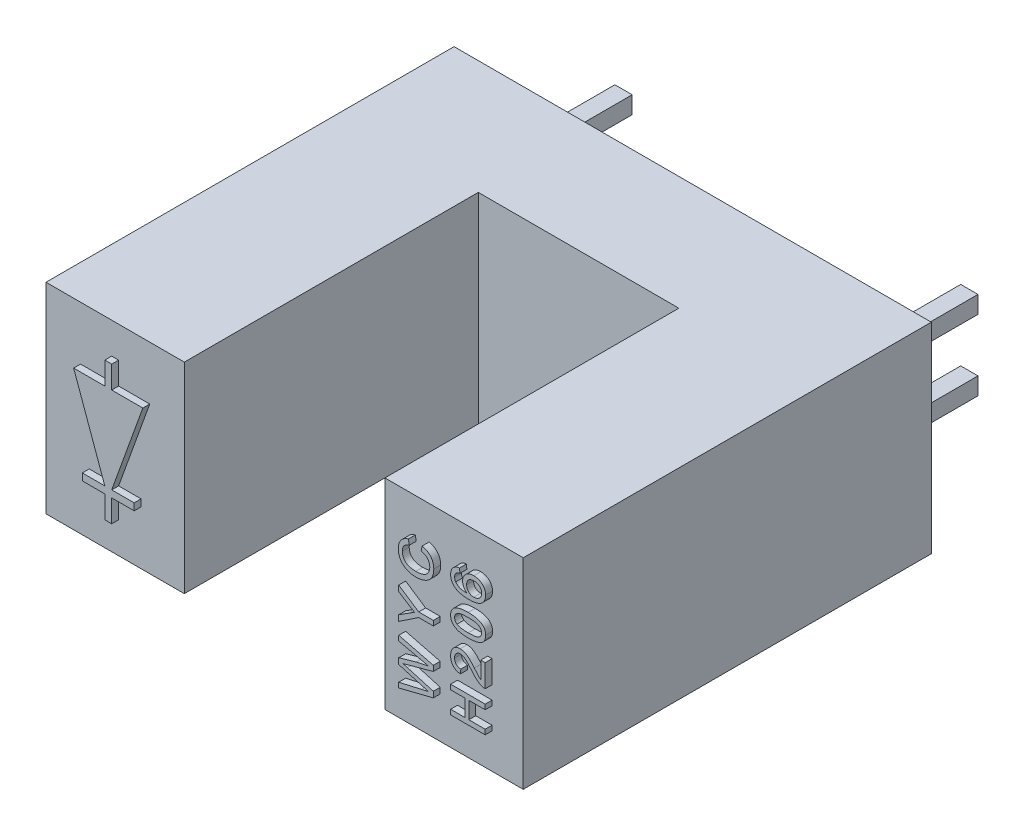
from build123d import *

# Parameters (mm, degrees)
SKETCH1_W           = 13.8
SKETCH1_H           = 5.8
BOSS_EXTRUDE1_DEPTH = 11.8
SKETCH2_W           = 5.8
SKETCH2_H           = 8.5
CUT_EXTRUDE1_DEPTH  = 11.8
BOSS_EXTRUDE3_DEPTH = 0.2
SKETCH4_W           = 0.5
SKETCH4_H           = 0.5
BOSS_EXTRUDE4_DEPTH = 3


with BuildPart() as part:
    # Sketch1 → Boss-Extrude1 (new body)
    with BuildSketch(Plane.XY):
        Rectangle(SKETCH1_W, SKETCH1_H)
    extrude(amount=BOSS_EXTRUDE1_DEPTH)

    # Sketch2 → Cut-Extrude1 (cut)
    with BuildSketch(Plane.XZ.offset(2.9)):
        with Locations((0, 7.55)):
            Rectangle(SKETCH2_W, SKETCH2_H)
    extrude(amount=-CUT_EXTRUDE1_DEPTH, mode=Mode.SUBTRACT)

    # Sketch3 → Boss-Extrude3 (add)
    # profile 1 of 8: a face of its own
    with BuildSketch(Plane.XY.offset(11.8)):
        Polygon((-5, 2), (-4.8, 2), (-4.8, 1.35), (-3.9, 1.35), (-4.8, -1.15), (-4.15, -1.15), (-4.15, -1.35), (-4.8, -1.35), (-4.8, -2), (-5, -2), (-5, -1.35), (-5.65, -1.35), (-5.65, -1.15), (-5, -1.15), (-5.9, 1.35), (-5, 1.35), align=None)
    # profile 2 of 8: a face of its own
    with BuildSketch(Plane.XY.offset(11.8)):
        with BuildLine():
            Line((4.147035256, 1.794871795), (4.179887821, 1.935897436))
            add(Edge.make_bspline(
                [(4.179887821, 1.935897436), (4.193105847, 1.932364452), (4.218961948, 1.925453496), (4.255963458, 1.911787877), (4.290693221, 1.896456639), (4.323034673, 1.879057674), (4.35284719, 1.859536419), (4.380280463, 1.83797815), (4.405378111, 1.814386055), (4.427830497, 1.788579096), (4.447912592, 1.761229193), (4.465124945, 1.732144912), (4.480134161, 1.701842258), (4.492164862, 1.6698256), (4.501290072, 1.636330013), (4.507919874, 1.601438978), (4.512008626, 1.565067725), (4.51254649, 1.540275182), (4.512820513, 1.527644231)],
                knots=[0, 0, 0, 0, 1.145367768, 2.240481511, 3.299486216, 4.322926322, 5.312543435, 6.280301985, 7.2416403, 8.192823262, 9.141388579, 10.079393599, 11.019812878, 11.970222822, 12.938950422, 13.923894909, 14.942295558, 16, 16, 16, 16], degree=3))
            add(Edge.make_bspline(
                [(4.512820513, 1.527644231), (4.512629827, 1.514685239), (4.512256766, 1.489332008), (4.509294356, 1.452181683), (4.503980094, 1.416896693), (4.49718236, 1.38335128), (4.487849908, 1.351783346), (4.476716774, 1.32196442), (4.463237211, 1.29415183), (4.447944601, 1.268051246), (4.430561914, 1.243785067), (4.411569158, 1.22079846), (4.390440574, 1.199650254), (4.367675801, 1.179811451), (4.342974329, 1.161714205), (4.316671796, 1.144692697), (4.288304736, 1.129577742), (4.25839908, 1.11580919), (4.227244366, 1.103724238), (4.195455987, 1.093033283), (4.162970601, 1.084292842), (4.130061567, 1.076767887), (4.096451977, 1.071301371), (4.062394008, 1.066961127), (4.027678853, 1.064574774), (4.004343579, 1.064260755), (3.992588141, 1.064102564)],
                knots=[0, 0, 0, 0, 1.180680974, 2.309907975, 3.39230657, 4.430402719, 5.425739985, 6.38846843, 7.327253855, 8.238163682, 9.141319901, 10.044148192, 10.951882972, 11.861898394, 12.79276478, 13.739539846, 14.714057202, 15.718574761, 16.737652364, 17.7573291, 18.772768038, 19.801551793, 20.831755737, 21.873891013, 22.928945814, 24, 24, 24, 24], degree=3))
            add(Edge.make_bspline(
                [(3.992588141, 1.064102564), (3.979897686, 1.064328855), (3.954824551, 1.064775948), (3.91782817, 1.067298653), (3.882123066, 1.071935418), (3.847681449, 1.078363092), (3.81442905, 1.086552175), (3.782358052, 1.096521775), (3.751598924, 1.108415011), (3.722143353, 1.121922538), (3.694351096, 1.137458072), (3.667974576, 1.154181217), (3.643527226, 1.172758929), (3.620558801, 1.192550156), (3.599460217, 1.214064734), (3.580181441, 1.237232888), (3.562547222, 1.261855817), (3.54672111, 1.287929636), (3.532834533, 1.315113607), (3.520465636, 1.343003941), (3.510327644, 1.371711574), (3.501898311, 1.401008903), (3.495187778, 1.430959003), (3.490700425, 1.461631856), (3.487776117, 1.492999118), (3.487379803, 1.514149376), (3.487179487, 1.524839744)],
                knots=[0, 0, 0, 0, 1.185610122, 2.34246615, 3.46204209, 4.547238403, 5.613845268, 6.659506797, 7.682407252, 8.692734231, 9.683951048, 10.654680354, 11.607833779, 12.549673105, 13.484816388, 14.419272854, 15.362680812, 16.31159957, 17.265732262, 18.21261905, 19.159670199, 20.10733745, 21.059306249, 22.024427552, 23.00144979, 24, 24, 24, 24], degree=3))
            add(Edge.make_bspline(
                [(3.487179487, 1.524839744), (3.487396057, 1.536802694), (3.487821748, 1.560317056), (3.491591672, 1.594776525), (3.497240699, 1.627917459), (3.505768841, 1.659481701), (3.516230675, 1.689766597), (3.529723974, 1.718295083), (3.545012852, 1.745647545), (3.562967467, 1.771317241), (3.582999509, 1.795380921), (3.605059756, 1.817621691), (3.629002205, 1.837998928), (3.655014144, 1.856260397), (3.682920025, 1.872656714), (3.712665197, 1.887364078), (3.744439288, 1.900032072), (3.766573885, 1.906806801), (3.777844551, 1.91025641)],
                knots=[0, 0, 0, 0, 1.098215313, 2.158650937, 3.179873416, 4.182349117, 5.157851008, 6.118027029, 7.076341197, 8.032298369, 8.990121974, 9.948357669, 10.905435138, 11.873450097, 12.863034414, 13.874936208, 14.917943528, 16, 16, 16, 16], degree=3))
            Line((3.777844551, 1.91025641), (3.808092949, 1.769230769))
            add(Edge.make_bspline(
                [(3.808092949, 1.769230769), (3.79944349, 1.766461246), (3.782513822, 1.761040431), (3.758386038, 1.751415245), (3.73598757, 1.741020365), (3.715470675, 1.729608177), (3.696830438, 1.717153947), (3.679840314, 1.703944464), (3.664817427, 1.689663241), (3.651415387, 1.674600771), (3.639998131, 1.658368097), (3.629880563, 1.641345783), (3.621509818, 1.623174913), (3.614429898, 1.604116889), (3.609041315, 1.583993578), (3.605250235, 1.562886924), (3.603056143, 1.540778383), (3.602730293, 1.525712653), (3.602564103, 1.518028846)],
                knots=[0, 0, 0, 0, 1.235697765, 2.418642872, 3.532555292, 4.594392283, 5.610119701, 6.580908344, 7.519430642, 8.427315627, 9.319973334, 10.216139639, 11.118687699, 12.038725643, 12.980015607, 13.949697744, 14.954307006, 16, 16, 16, 16], degree=3))
            add(Edge.make_bspline(
                [(3.602564103, 1.518028846), (3.602692216, 1.509207185), (3.602944176, 1.49185758), (3.605697611, 1.466368028), (3.609761763, 1.441892607), (3.615825303, 1.418597984), (3.623481704, 1.396438827), (3.632629014, 1.375314698), (3.643761743, 1.355365347), (3.656522816, 1.336611036), (3.670848503, 1.319158304), (3.68623925, 1.302945704), (3.702731092, 1.288014027), (3.720422087, 1.274542421), (3.739376859, 1.262528378), (3.759414906, 1.251656119), (3.780670287, 1.2422685), (3.810484257, 1.231657812), (3.848957986, 1.221225174), (3.896009808, 1.211955577), (3.94376286, 1.206110642), (3.975878417, 1.205456377), (3.991987179, 1.205128205)],
                knots=[0, 0, 0, 0, 0.935100075, 1.839065892, 2.715632844, 3.564034634, 4.388093667, 5.199800233, 6.00171917, 6.806945003, 7.602082793, 8.393428172, 9.17553264, 9.958694158, 10.748327009, 11.553054559, 12.374096334, 13.209545573, 14.906836637, 16.595465087, 18.292327764, 20, 20, 20, 20], degree=3))
            add(Edge.make_bspline(
                [(3.991987179, 1.205128205), (4.012240929, 1.205502448), (4.051601361, 1.206229738), (4.108557606, 1.213231809), (4.161657896, 1.224079711), (4.203038666, 1.237042149), (4.233605465, 1.250081692), (4.25501216, 1.260625549), (4.274820796, 1.272661436), (4.293143977, 1.285889419), (4.309928226, 1.300480034), (4.325262712, 1.316229966), (4.339294984, 1.333142743), (4.351368169, 1.351418764), (4.362088103, 1.370354561), (4.371620474, 1.38971118), (4.379682532, 1.409500809), (4.385945302, 1.42980329), (4.391357205, 1.450333523), (4.394892515, 1.471317625), (4.396887732, 1.492749614), (4.397251711, 1.507140665), (4.397435897, 1.514423077)],
                knots=[0, 0, 0, 0, 2.106854985, 4.094388766, 5.961441423, 7.741458329, 8.594569961, 9.418076185, 10.222480919, 11.003619353, 11.767127393, 12.533696482, 13.289066307, 14.050325982, 14.809648647, 15.552384038, 16.294338903, 17.030544626, 17.761979889, 18.502240791, 19.242077596, 20, 20, 20, 20], degree=3))
            add(Edge.make_bspline(
                [(4.397435897, 1.514423077), (4.397253638, 1.523113639), (4.396893611, 1.540280571), (4.393742278, 1.565449473), (4.389098375, 1.589711948), (4.381932365, 1.612774059), (4.373158424, 1.634946017), (4.362338622, 1.656046162), (4.349325557, 1.676008137), (4.334550444, 1.695066737), (4.317738891, 1.712870507), (4.299026339, 1.729186704), (4.27832748, 1.743824177), (4.255974502, 1.757396798), (4.231299637, 1.768800294), (4.205038336, 1.779362624), (4.176758969, 1.78816392), (4.157085489, 1.792603717), (4.147035256, 1.794871795)],
                knots=[0, 0, 0, 0, 1.013374089, 2.001772144, 2.95501459, 3.891367103, 4.814208647, 5.733921849, 6.652182523, 7.590185968, 8.54346024, 9.504121027, 10.481158517, 11.497760682, 12.549996529, 13.647863555, 14.798406869, 16, 16, 16, 16], degree=3))
        make_face()
    # profile 3 of 8: a face of its own
    with BuildSketch(Plane.XY.offset(11.8)):
        with BuildLine():
            Line((4.5, 0.091145833), (4.076322115, 0.091145833))
            Line((4.076322115, 0.091145833), (3.5, -0.293469551))
            Line((3.5, -0.293469551), (3.5, -0.126602564))
            Line((3.5, -0.126602564), (3.805689103, 0.067307692))
            add(Edge.make_bspline(
                [(3.805689103, 0.067307692), (3.819306362, 0.07599538), (3.845729199, 0.09285291), (3.884172831, 0.117215151), (3.920081058, 0.140182031), (3.943300888, 0.154794242), (3.954527244, 0.161858974)],
                knots=[0, 0, 0, 0, 1.099240192, 2.132958167, 3.097319992, 4, 4, 4, 4], degree=3))
            add(Edge.make_bspline(
                [(3.954527244, 0.161858974), (3.943447665, 0.168944543), (3.919774136, 0.184084146), (3.881934432, 0.208050486), (3.839643344, 0.234961721), (3.809901613, 0.253748431), (3.794270833, 0.263621795)],
                knots=[0, 0, 0, 0, 0.831336673, 1.776301659, 2.8313344, 4, 4, 4, 4], degree=3))
            Line((3.794270833, 0.263621795), (3.5, 0.449919872))
            Line((3.5, 0.449919872), (3.5, 0.616786859))
            Line((3.5, 0.616786859), (4.076322115, 0.232171474))
            Line((4.076322115, 0.232171474), (4.5, 0.232171474))
            Line((4.5, 0.232171474), (4.5, 0.091145833))
        make_face()
    # profile 4 of 8: a face of its own
    with BuildSketch(Plane.XY.offset(11.8)):
        with BuildLine():
            Line((4.5, -1.709735577), (3.5, -1.961538462))
            Line((3.5, -1.961538462), (3.5, -1.815905449))
            Line((3.5, -1.815905449), (4.157652244, -1.667467949))
            add(Edge.make_bspline(
                [(4.157652244, -1.667467949), (4.191570026, -1.659774994), (4.259059319, -1.644467624), (4.326586116, -1.629326561), (4.360176282, -1.621794872)],
                knots=[0, 0, 0, 0, 1.00513078, 2, 2, 2, 2], degree=3))
            add(Edge.make_bspline(
                [(4.360176282, -1.621794872), (4.34809809, -1.618228853), (4.325296663, -1.61149686), (4.292973444, -1.602396511), (4.264762638, -1.594130955), (4.240532729, -1.587089125), (4.220249676, -1.581387383), (4.204162716, -1.576464563), (4.191956814, -1.573109231), (4.18522766, -1.571120855), (4.182491987, -1.5703125)],
                knots=[0, 0, 0, 0, 1.633809233, 3.084334118, 4.356383392, 5.447555203, 6.357852567, 7.089694452, 7.629924063, 8, 8, 8, 8], degree=3))
            Line((4.182491987, -1.5703125), (3.5, -1.372796474))
            Line((3.5, -1.372796474), (3.5, -1.203125))
            Line((3.5, -1.203125), (4.001001603, -1.060296474))
            add(Edge.make_bspline(
                [(4.001001603, -1.060296474), (4.031951517, -1.052414329), (4.092978049, -1.036872443), (4.18387933, -1.01622254), (4.272575327, -0.997163339), (4.331238072, -0.986184881), (4.360176282, -0.980769231)],
                knots=[0, 0, 0, 0, 1.04154457, 2.053700482, 3.039894486, 4, 4, 4, 4], degree=3))
            add(Edge.make_bspline(
                [(4.360176282, -0.980769231), (4.345417199, -0.977440014), (4.314224495, -0.970403853), (4.265124545, -0.959118474), (4.211055866, -0.947183068), (4.173474248, -0.938716686), (4.153846154, -0.934294872)],
                knots=[0, 0, 0, 0, 0.858435927, 1.814268333, 2.85843797, 4, 4, 4, 4], degree=3))
            Line((4.153846154, -0.934294872), (3.5, -0.786658654))
            Line((3.5, -0.786658654), (3.5, -0.641025641))
            Line((3.5, -0.641025641), (4.5, -0.893028846))
            Line((4.5, -0.893028846), (4.5, -1.048076923))
            Line((4.5, -1.048076923), (3.735777244, -1.257011218))
            add(Edge.make_bspline(
                [(3.735777244, -1.257011218), (3.728306256, -1.259109219), (3.714114161, -1.26309464), (3.693861561, -1.268318594), (3.676050233, -1.273499032), (3.660449993, -1.277619559), (3.647218045, -1.28118553), (3.63639313, -1.28434335), (3.627763386, -1.286374375), (3.622858496, -1.287843118), (3.620793269, -1.288461538)],
                knots=[0, 0, 0, 0, 1.562239628, 2.967673567, 4.210417925, 5.296319877, 6.215971374, 6.969386481, 7.566055473, 8, 8, 8, 8], degree=3))
            add(Edge.make_bspline(
                [(3.620793269, -1.288461538), (3.633887109, -1.292179268), (3.658689687, -1.299221456), (3.693562227, -1.309477249), (3.724162895, -1.318294659), (3.74305638, -1.323781876), (3.751802885, -1.326322115)],
                knots=[0, 0, 0, 0, 1.197732026, 2.268764715, 3.198546125, 4, 4, 4, 4], degree=3))
            Line((3.751802885, -1.326322115), (4.5, -1.54286859))
            Line((4.5, -1.54286859), (4.5, -1.709735577))
        make_face()
    # profile 5 of 8: a face of its own
    with BuildSketch(Plane.XY.offset(11.8)):
        with BuildLine():
            Line((5.256410256, 1.923076923), (5.269230769, 1.794871795))
            add(Edge.make_bspline(
                [(5.269230769, 1.794871795), (5.258204444, 1.792105231), (5.237449084, 1.786897601), (5.20929757, 1.77597725), (5.185486177, 1.763943255), (5.172664399, 1.75348833), (5.166666667, 1.748597756)],
                knots=[0, 0, 0, 0, 1.199207122, 2.257322842, 3.184815751, 4, 4, 4, 4], degree=3))
            add(Edge.make_bspline(
                [(5.166666667, 1.748597756), (5.162575884, 1.744399768), (5.154530261, 1.736143296), (5.144042734, 1.722589175), (5.135157175, 1.708300887), (5.127958526, 1.693235249), (5.122272005, 1.677473651), (5.118293982, 1.660950805), (5.115831359, 1.643704143), (5.115534798, 1.631952697), (5.115384615, 1.626001603)],
                knots=[0, 0, 0, 0, 1.028360939, 2.022547923, 3.001693811, 3.976902288, 4.948369586, 5.937776631, 6.955661634, 8, 8, 8, 8], degree=3))
            add(Edge.make_bspline(
                [(5.115384615, 1.626001603), (5.115695261, 1.616353854), (5.116309083, 1.597290325), (5.122318354, 1.569320721), (5.131312186, 1.542154374), (5.140429289, 1.525323817), (5.145032051, 1.516826923)],
                knots=[0, 0, 0, 0, 1.010336883, 1.996381556, 2.988474728, 4, 4, 4, 4], degree=3))
            add(Edge.make_bspline(
                [(5.145032051, 1.516826923), (5.151953962, 1.508468762), (5.166162989, 1.491311457), (5.192403721, 1.468995086), (5.22283175, 1.448862852), (5.251387315, 1.434080282), (5.277090308, 1.42380303), (5.299070054, 1.417030941), (5.323306003, 1.411299754), (5.349789639, 1.406513718), (5.378549154, 1.402815335), (5.4096008, 1.399723181), (5.443023909, 1.39801319), (5.466077383, 1.397632301), (5.477964744, 1.397435897)],
                knots=[0, 0, 0, 0, 1.063250814, 2.182599524, 3.36380985, 4.638540699, 5.329632219, 6.077757597, 6.893023137, 7.772089793, 8.717285182, 9.73761699, 10.83341823, 12, 12, 12, 12], degree=3))
            add(Edge.make_bspline(
                [(5.477964744, 1.397435897), (5.467345054, 1.404994395), (5.446556362, 1.419790615), (5.419365933, 1.445893056), (5.396371069, 1.474392713), (5.378048634, 1.505335186), (5.36371974, 1.537845257), (5.353894049, 1.57141605), (5.347199476, 1.605638293), (5.346504042, 1.628774237), (5.346153846, 1.640424679)],
                knots=[0, 0, 0, 0, 1.084001636, 2.121999332, 3.126469213, 4.123683166, 5.106931922, 6.075998312, 7.03114091, 8, 8, 8, 8], degree=3))
            add(Edge.make_bspline(
                [(5.346153846, 1.640424679), (5.346423678, 1.65045367), (5.346956783, 1.670267847), (5.351181395, 1.699446461), (5.358570516, 1.727420173), (5.368196602, 1.7544313), (5.38133981, 1.779961161), (5.396701155, 1.804631358), (5.415391005, 1.827876161), (5.436403199, 1.849967726), (5.459759969, 1.870182231), (5.485024, 1.887792347), (5.511880118, 1.902828808), (5.540493277, 1.914783916), (5.570734196, 1.92425747), (5.602585298, 1.931019632), (5.63611256, 1.935090094), (5.658976156, 1.935624193), (5.670673077, 1.935897436)],
                knots=[0, 0, 0, 0, 0.981582189, 1.939302258, 2.87789191, 3.810544529, 4.740168451, 5.683209003, 6.65100384, 7.654285831, 8.664634098, 9.669256765, 10.664156186, 11.671836555, 12.699357328, 13.762200315, 14.855150938, 16, 16, 16, 16], degree=3))
            add(Edge.make_bspline(
                [(5.670673077, 1.935897436), (5.686129083, 1.935391855), (5.716696989, 1.93439195), (5.761639418, 1.926574276), (5.804911071, 1.913733839), (5.839149278, 1.898552199), (5.865418574, 1.884555998), (5.883793231, 1.872674732), (5.901060584, 1.859969527), (5.917458504, 1.846681971), (5.93223642, 1.831848063), (5.946090677, 1.816367181), (5.958542292, 1.799727607), (5.97000557, 1.782418733), (5.979945402, 1.764113582), (5.988778017, 1.745344785), (5.99630178, 1.725957839), (6.002209204, 1.705890146), (6.007096537, 1.685244482), (6.010457028, 1.663952129), (6.012529529, 1.642069126), (6.012722767, 1.627274981), (6.012820513, 1.619791667)],
                knots=[0, 0, 0, 0, 1.777960384, 3.516337103, 5.232817765, 6.960340972, 7.816514579, 8.656393217, 9.475627613, 10.283429005, 11.082224935, 11.882498067, 12.672484914, 13.471761235, 14.269669532, 15.067244712, 15.857866702, 16.660166545, 17.47288749, 18.29786845, 19.139011754, 20, 20, 20, 20], degree=3))
            add(Edge.make_bspline(
                [(6.012820513, 1.619791667), (6.012470057, 1.607153749), (6.01178275, 1.58236857), (6.006502553, 1.546091835), (5.9976786, 1.511645489), (5.985341717, 1.478956259), (5.969766655, 1.447924562), (5.950242242, 1.41885621), (5.927347405, 1.391590358), (5.900949365, 1.366105989), (5.870467568, 1.342999333), (5.83528222, 1.323251344), (5.795701316, 1.306424304), (5.751615956, 1.292652837), (5.702980037, 1.282231811), (5.649898013, 1.274728234), (5.592362283, 1.270113617), (5.552492946, 1.269531932), (5.531850962, 1.269230769)],
                knots=[0, 0, 0, 0, 0.898506621, 1.76212948, 2.600594211, 3.422599815, 4.24233914, 5.064166416, 5.906856258, 6.769969817, 7.668413694, 8.619051846, 9.63165591, 10.722000005, 11.898403521, 13.164960021, 14.532183992, 16, 16, 16, 16], degree=3))
            add(Edge.make_bspline(
                [(5.531850962, 1.269230769), (5.52009675, 1.269280706), (5.496913427, 1.269379199), (5.462793354, 1.270961888), (5.429842176, 1.272777428), (5.398191353, 1.27588807), (5.367698531, 1.279560921), (5.338543029, 1.284489839), (5.310498228, 1.289782903), (5.283784935, 1.296218188), (5.258151844, 1.303391958), (5.233880609, 1.311649217), (5.210657203, 1.320370928), (5.188847974, 1.330265528), (5.168097725, 1.340810866), (5.148790444, 1.352467193), (5.130484666, 1.364691514), (5.119196748, 1.373716016), (5.113581731, 1.378205128)],
                knots=[0, 0, 0, 0, 1.28053818, 2.525659045, 3.721026795, 4.875695215, 5.990149104, 7.066600796, 8.096771069, 9.099076143, 10.059445332, 10.995815448, 11.891625124, 12.761078582, 13.603822678, 14.426062074, 15.217066536, 16, 16, 16, 16], degree=3))
            add(Edge.make_bspline(
                [(5.113581731, 1.378205128), (5.10449801, 1.386280961), (5.086593153, 1.402199177), (5.063464318, 1.429430239), (5.043708735, 1.45844723), (5.027747935, 1.489712936), (5.015304382, 1.52298839), (5.006271466, 1.558294454), (5.001032997, 1.595729648), (5.000349914, 1.621310915), (5, 1.634415064)],
                knots=[0, 0, 0, 0, 1.005002357, 1.980952959, 2.948226316, 3.90482984, 4.879026092, 5.883055346, 6.915583142, 8, 8, 8, 8], degree=3))
            add(Edge.make_bspline(
                [(5, 1.634415064), (5.000172482, 1.644172558), (5.000511338, 1.66334194), (5.00376269, 1.691429978), (5.009196838, 1.718146637), (5.016526897, 1.743551424), (5.02628414, 1.767496615), (5.03784753, 1.790258271), (5.051757561, 1.811605264), (5.067824192, 1.831383054), (5.085591976, 1.849640629), (5.105210121, 1.865993686), (5.126434114, 1.880380606), (5.149308099, 1.892913897), (5.173723797, 1.903481563), (5.199786144, 1.912158142), (5.227488441, 1.918752922), (5.246636019, 1.92161561), (5.256410256, 1.923076923)],
                knots=[0, 0, 0, 0, 1.095988384, 2.15315746, 3.171326302, 4.156539379, 5.119213808, 6.072133135, 7.021027441, 7.975952916, 8.930907862, 9.879001051, 10.840359051, 11.807350428, 12.805278655, 13.825435679, 14.889953203, 16, 16, 16, 16], degree=3))
        make_face()
        with BuildLine():
            add(Edge.make_bspline(
                [(5.66806891, 1.397435897), (5.678106694, 1.397794447), (5.698050486, 1.398506838), (5.727601586, 1.403885744), (5.756393044, 1.412817426), (5.784195287, 1.4248845), (5.810075109, 1.439941455), (5.833155165, 1.457605524), (5.852830116, 1.477828236), (5.869005759, 1.500475655), (5.881572921, 1.525247165), (5.891002243, 1.551788924), (5.896442344, 1.580307314), (5.89709971, 1.599937036), (5.897435897, 1.609975962)],
                knots=[0, 0, 0, 0, 1.034371533, 2.055163721, 3.085036369, 4.136219926, 5.172765015, 6.164074703, 7.123048089, 8.070464312, 9.021723619, 9.977430468, 10.965628467, 12, 12, 12, 12], degree=3))
            add(Edge.make_bspline(
                [(5.897435897, 1.609975962), (5.897242385, 1.617131179), (5.896864665, 1.631097531), (5.893937718, 1.651546538), (5.889436944, 1.67105715), (5.882787081, 1.689516396), (5.874300026, 1.706899224), (5.863970724, 1.723295892), (5.851768249, 1.738695795), (5.837714999, 1.752912736), (5.82208526, 1.765761776), (5.804974942, 1.776925887), (5.786665556, 1.786784841), (5.766707156, 1.794200347), (5.745611055, 1.800242912), (5.723177784, 1.804685351), (5.699381585, 1.80729353), (5.683032766, 1.807557457), (5.674679487, 1.807692308)],
                knots=[0, 0, 0, 0, 1.023436885, 1.997658284, 2.950132304, 3.883974581, 4.798406504, 5.712938251, 6.651509614, 7.604127386, 8.56812849, 9.540661787, 10.523651728, 11.536824179, 12.580180944, 13.661349568, 14.805088061, 16, 16, 16, 16], degree=3))
            add(Edge.make_bspline(
                [(5.674679487, 1.807692308), (5.66665784, 1.807567504), (5.650970498, 1.807323435), (5.628081262, 1.804567476), (5.606435605, 1.800571538), (5.586189188, 1.794351975), (5.567129474, 1.786957098), (5.549579063, 1.777329934), (5.533184448, 1.766305074), (5.51825232, 1.753487942), (5.504762695, 1.739345621), (5.493312632, 1.723692116), (5.48340609, 1.707034482), (5.475340272, 1.689026935), (5.469142789, 1.66973629), (5.464851948, 1.649184219), (5.461855576, 1.627491484), (5.461645787, 1.612590881), (5.461538462, 1.604967949)],
                knots=[0, 0, 0, 0, 1.155514215, 2.259753865, 3.318605965, 4.323374797, 5.308078351, 6.25972982, 7.201991692, 8.150865321, 9.090370884, 10.012362416, 10.939962465, 11.879024295, 12.84989812, 13.854113716, 14.902195686, 16, 16, 16, 16], degree=3))
            add(Edge.make_bspline(
                [(5.461538462, 1.604967949), (5.461649204, 1.597878611), (5.461867434, 1.583908397), (5.464887171, 1.563421239), (5.469186629, 1.543674702), (5.475447816, 1.52475268), (5.483489286, 1.506629996), (5.493331819, 1.489414008), (5.504900001, 1.472952733), (5.518192619, 1.457535283), (5.532890336, 1.443292432), (5.548982492, 1.43101973), (5.566211903, 1.420813056), (5.584282632, 1.412031911), (5.603662199, 1.405419932), (5.624166, 1.40091402), (5.64575122, 1.398012589), (5.660513938, 1.397631119), (5.66806891, 1.397435897)],
                knots=[0, 0, 0, 0, 1.036834006, 2.043179957, 3.024920909, 3.992398523, 4.95507473, 5.922552344, 6.890671636, 7.895735102, 8.898133371, 9.881478754, 10.850387221, 11.825341133, 12.817584876, 13.839615819, 14.894401237, 16, 16, 16, 16], degree=3))
        make_face(mode=Mode.SUBTRACT)
    # profile 6 of 8: a face of its own
    with BuildSketch(Plane.XY.offset(11.8)):
        with BuildLine():
            add(Edge.make_bspline(
                [(5.506810897, 0.294871795), (5.492519986, 0.295000996), (5.464530109, 0.295254048), (5.423575777, 0.296822732), (5.384683567, 0.299564096), (5.347885341, 0.303647711), (5.313039683, 0.308520108), (5.280239641, 0.314762103), (5.249447735, 0.321884411), (5.220783, 0.330329588), (5.193940522, 0.339754973), (5.168870888, 0.350303404), (5.145580506, 0.362210757), (5.123904749, 0.374961835), (5.103997323, 0.388803673), (5.085822106, 0.403718771), (5.069320449, 0.419732877), (5.054684523, 0.437012512), (5.041759256, 0.455391984), (5.030542549, 0.474821763), (5.020988323, 0.495439698), (5.0135033, 0.517304541), (5.007478837, 0.540203306), (5.003025331, 0.564226654), (5.000405057, 0.589417399), (5.000136544, 0.606631092), (5, 0.615384615)],
                knots=[0, 0, 0, 0, 1.514579231, 2.966422906, 4.342888004, 5.645649548, 6.889653673, 8.070797339, 9.183112822, 10.237837631, 11.23608981, 12.196917133, 13.117904763, 14.006315217, 14.860292005, 15.684850496, 16.495566347, 17.293863258, 18.081168691, 18.873799386, 19.668575398, 20.485475899, 21.319695627, 22.176102692, 23.072510053, 24, 24, 24, 24], degree=3))
            add(Edge.make_bspline(
                [(5, 0.615384615), (5.000371326, 0.62822913), (5.001100811, 0.653462693), (5.007235668, 0.690253222), (5.017254547, 0.72504783), (5.031307327, 0.757565554), (5.04898383, 0.787526484), (5.070783649, 0.814064224), (5.095909769, 0.837335291), (5.124976662, 0.856780756), (5.157116975, 0.873793233), (5.192502039, 0.888902329), (5.231084405, 0.902561825), (5.265621475, 0.912254586), (5.295434993, 0.919168497), (5.320024355, 0.923744946), (5.346556411, 0.92754432), (5.374966977, 0.930455152), (5.405224188, 0.932843422), (5.437346882, 0.934687773), (5.471415344, 0.935623971), (5.494791195, 0.935804572), (5.506810897, 0.935897436)],
                knots=[0, 0, 0, 0, 1.134369906, 2.228515181, 3.285355733, 4.326599491, 5.350616376, 6.348601676, 7.350764122, 8.365406289, 9.429174435, 10.560286681, 11.762070813, 13.043401781, 13.727542782, 14.465843617, 15.252693982, 16.095180924, 16.988916914, 17.934437918, 18.937902156, 20, 20, 20, 20], degree=3))
            add(Edge.make_bspline(
                [(5.506810897, 0.935897436), (5.521034686, 0.935765839), (5.548823658, 0.935508739), (5.589449545, 0.933981762), (5.628048546, 0.931076507), (5.664709757, 0.927504004), (5.699332959, 0.922090496), (5.732009387, 0.916297016), (5.762628181, 0.909036471), (5.791294836, 0.900618955), (5.818184528, 0.891218081), (5.843337376, 0.880861488), (5.866685184, 0.869183811), (5.88831765, 0.856408201), (5.908235883, 0.842502159), (5.926584474, 0.82771818), (5.943105044, 0.811637979), (5.957715531, 0.794296267), (5.970876016, 0.776039821), (5.982144354, 0.756506739), (5.991479942, 0.735782181), (5.999461415, 0.714004705), (6.005309768, 0.690953323), (6.009786591, 0.666809823), (6.012422869, 0.641485245), (6.012686136, 0.624204862), (6.012820513, 0.615384615)],
                knots=[0, 0, 0, 0, 1.509004079, 2.9481365, 4.311841541, 5.615149582, 6.854413858, 8.028470806, 9.134999426, 10.19077436, 11.196702255, 12.155743144, 13.07445799, 13.963752978, 14.818580019, 15.649443378, 16.460966408, 17.260058134, 18.052243746, 18.845663614, 19.647670084, 20.461076897, 21.302979722, 22.167206202, 23.06450606, 24, 24, 24, 24], degree=3))
            add(Edge.make_bspline(
                [(6.012820513, 0.615384615), (6.012490639, 0.603820249), (6.011847475, 0.581272918), (6.007477573, 0.548344204), (5.99978634, 0.51743885), (5.989471313, 0.488296185), (5.97567437, 0.461243783), (5.958887695, 0.436152479), (5.939501847, 0.41251808), (5.924206858, 0.398912684), (5.916466346, 0.392027244)],
                knots=[0, 0, 0, 0, 1.10322584, 2.150986741, 3.161425019, 4.136713905, 5.093944212, 6.049774532, 7.013026876, 8, 8, 8, 8], degree=3))
            add(Edge.make_bspline(
                [(5.916466346, 0.392027244), (5.905033985, 0.384101944), (5.881459966, 0.367759636), (5.841264077, 0.348632381), (5.797014046, 0.331570532), (5.747841695, 0.318180108), (5.694138378, 0.307692068), (5.635798718, 0.300117085), (5.572847921, 0.29583039), (5.529320154, 0.29519854), (5.506810897, 0.294871795)],
                knots=[0, 0, 0, 0, 0.779365345, 1.607084704, 2.489375761, 3.438383567, 4.461919411, 5.557722155, 6.737039282, 8, 8, 8, 8], degree=3))
        make_face()
        with BuildLine():
            add(Edge.make_bspline(
                [(5.506410256, 0.423076923), (5.525643894, 0.423204221), (5.56246133, 0.423447896), (5.615061389, 0.425993714), (5.662513822, 0.430376236), (5.704752929, 0.436170215), (5.741835846, 0.443820613), (5.773668073, 0.453426594), (5.800631671, 0.464254818), (5.822392446, 0.477654541), (5.840130652, 0.492325757), (5.855386082, 0.507472785), (5.868352849, 0.523451982), (5.879164488, 0.540159086), (5.887350351, 0.55785332), (5.893283483, 0.576341199), (5.896697909, 0.595626747), (5.897188498, 0.608761082), (5.897435897, 0.615384615)],
                knots=[0, 0, 0, 0, 1.89448813, 3.626469325, 5.185477471, 6.587276848, 7.82441448, 8.910550357, 9.859733512, 10.6775885, 11.416198291, 12.123144072, 12.791880183, 13.439617036, 14.078171869, 14.70637855, 15.347637704, 16, 16, 16, 16], degree=3))
            add(Edge.make_bspline(
                [(5.897435897, 0.615384615), (5.897183157, 0.622006544), (5.896681978, 0.635137696), (5.893341893, 0.654467022), (5.887106881, 0.672885898), (5.878936492, 0.69054267), (5.868400251, 0.707449529), (5.855146849, 0.723209776), (5.839937734, 0.738526581), (5.821996925, 0.75304137), (5.800243879, 0.766529541), (5.773263156, 0.77733731), (5.74143682, 0.786951951), (5.704415581, 0.79457733), (5.662249621, 0.800412517), (5.61492679, 0.804763077), (5.562395025, 0.807327606), (5.525644028, 0.807567013), (5.506410256, 0.807692308)],
                knots=[0, 0, 0, 0, 0.652578524, 1.294050225, 1.924494109, 2.563260593, 3.207694917, 3.880813851, 4.587993952, 5.331957758, 6.150083828, 7.099581593, 8.186077474, 9.42362516, 10.819375359, 12.378900244, 14.104883934, 16, 16, 16, 16], degree=3))
            add(Edge.make_bspline(
                [(5.506410256, 0.807692308), (5.487576724, 0.8075709), (5.451492389, 0.807338287), (5.399905671, 0.804709332), (5.353249707, 0.800589523), (5.311481485, 0.794954279), (5.27464635, 0.787465041), (5.242665884, 0.778381617), (5.215608292, 0.767557359), (5.193201779, 0.754687355), (5.17482236, 0.740360465), (5.158913374, 0.725394671), (5.145383299, 0.709415825), (5.134529274, 0.692140831), (5.12577265, 0.674126495), (5.119746118, 0.654958892), (5.116043606, 0.634826425), (5.115606789, 0.621009775), (5.115384615, 0.613982372)],
                knots=[0, 0, 0, 0, 1.850066095, 3.544656626, 5.0727657, 6.45041401, 7.682899467, 8.762389858, 9.712573485, 10.538438529, 11.291566246, 11.996865408, 12.681389046, 13.341983376, 13.996294293, 14.643563182, 15.31009126, 16, 16, 16, 16], degree=3))
            add(Edge.make_bspline(
                [(5.115384615, 0.613982372), (5.115556636, 0.607358402), (5.11589584, 0.594296781), (5.119193568, 0.575187562), (5.124576982, 0.556995529), (5.132342712, 0.53984175), (5.141976862, 0.523556431), (5.153694886, 0.508119809), (5.167857381, 0.493901995), (5.178468088, 0.485345304), (5.183894231, 0.480969551)],
                knots=[0, 0, 0, 0, 1.021462953, 2.014194051, 2.982449609, 3.941891643, 4.91211921, 5.897280499, 6.924703483, 8, 8, 8, 8], degree=3))
            add(Edge.make_bspline(
                [(5.183894231, 0.480969551), (5.191860783, 0.476204348), (5.208684463, 0.466141242), (5.23792562, 0.454885406), (5.271400979, 0.444903722), (5.309523486, 0.436796624), (5.352240785, 0.430797735), (5.399484749, 0.426151629), (5.451430218, 0.423714806), (5.487577938, 0.423295417), (5.506410256, 0.423076923)],
                knots=[0, 0, 0, 0, 0.671109831, 1.417242661, 2.260125669, 3.199948126, 4.23589883, 5.382398214, 6.636276086, 8, 8, 8, 8], degree=3))
        make_face(mode=Mode.SUBTRACT)
    # profile 7 of 8: a face of its own
    with BuildSketch(Plane.XY.offset(11.8)):
        with BuildLine():
            Line((5.871794872, -0.076923077), (6, -0.076923077))
            Line((6, -0.076923077), (6, -0.730769231))
            add(Edge.make_bspline(
                [(6, -0.730769231), (5.992379863, -0.730787009), (5.977231587, -0.730822349), (5.954739854, -0.728194718), (5.932525686, -0.724234912), (5.918227575, -0.719647929), (5.911057692, -0.717347756)],
                knots=[0, 0, 0, 0, 1.010600758, 2.009000657, 3.001600101, 4, 4, 4, 4], degree=3))
            add(Edge.make_bspline(
                [(5.911057692, -0.717347756), (5.899335762, -0.713116909), (5.875524245, -0.704522514), (5.841197947, -0.686847225), (5.806876813, -0.666453664), (5.779004493, -0.646329173), (5.756747768, -0.627980207), (5.739338378, -0.612585071), (5.72151667, -0.595526541), (5.703287354, -0.576815771), (5.68453194, -0.556633571), (5.665188003, -0.534952191), (5.645616004, -0.511515669), (5.63264287, -0.495154522), (5.626001603, -0.486778846)],
                knots=[0, 0, 0, 0, 1.204682444, 2.447149603, 3.728063212, 5.065745198, 5.768097617, 6.518745349, 7.313897871, 8.154576377, 9.046034033, 9.979646649, 10.965731253, 12, 12, 12, 12], degree=3))
            add(Edge.make_bspline(
                [(5.626001603, -0.486778846), (5.615171568, -0.473911741), (5.594317649, -0.449135315), (5.563372377, -0.4141471), (5.534637899, -0.382191128), (5.507610761, -0.353775965), (5.482552539, -0.328670174), (5.459521826, -0.306811722), (5.438584782, -0.288022211), (5.419001464, -0.272501072), (5.40051333, -0.259508353), (5.382579161, -0.248227834), (5.364570977, -0.239172196), (5.346830767, -0.231401098), (5.329288473, -0.225372209), (5.311786969, -0.221129236), (5.294491928, -0.218387433), (5.282929076, -0.218093329), (5.27724359, -0.217948718)],
                knots=[0, 0, 0, 0, 1.782511555, 3.432339066, 4.950556168, 6.337242158, 7.588364383, 8.709771971, 9.70247892, 10.569050646, 11.3564271, 12.096888545, 12.812232926, 13.490631961, 14.148641375, 14.7751826, 15.397753892, 16, 16, 16, 16], degree=3))
            add(Edge.make_bspline(
                [(5.27724359, -0.217948718), (5.271623512, -0.218087902), (5.260597224, -0.218360972), (5.244460544, -0.220952392), (5.228919673, -0.224558675), (5.214258433, -0.230393468), (5.200027435, -0.23732307), (5.186690328, -0.246301556), (5.173743226, -0.256464555), (5.161863158, -0.26833705), (5.150732313, -0.281215531), (5.14141928, -0.295545028), (5.133365755, -0.310619915), (5.126603111, -0.326592948), (5.121700654, -0.343700926), (5.118122596, -0.361726991), (5.115859045, -0.380685949), (5.115545156, -0.393623414), (5.115384615, -0.400240385)],
                knots=[0, 0, 0, 0, 0.987973548, 1.938350371, 2.870100611, 3.788647624, 4.708095761, 5.649791829, 6.611214459, 7.599816467, 8.600146238, 9.60047601, 10.599079585, 11.604913276, 12.645813302, 13.724097821, 14.835971573, 16, 16, 16, 16], degree=3))
            add(Edge.make_bspline(
                [(5.115384615, -0.400240385), (5.115544368, -0.407191329), (5.115857016, -0.420794838), (5.118129512, -0.440680571), (5.121609987, -0.459554702), (5.126901452, -0.477390235), (5.13365739, -0.494071863), (5.141792226, -0.509796077), (5.151357874, -0.524446181), (5.162596231, -0.537814751), (5.175083047, -0.549894483), (5.188675298, -0.560611085), (5.20367308, -0.56946079), (5.21978781, -0.576611484), (5.236918577, -0.582504888), (5.255235528, -0.586729943), (5.27471475, -0.589042517), (5.28805526, -0.589506507), (5.294871795, -0.58974359)],
                knots=[0, 0, 0, 0, 1.130801575, 2.213061782, 3.252933619, 4.249917472, 5.234510032, 6.17726912, 7.126517163, 8.075267631, 9.012689889, 9.949419277, 10.884824487, 11.837981854, 12.813782694, 13.828488442, 14.890433304, 16, 16, 16, 16], degree=3))
            Line((5.294871795, -0.58974359), (5.282051282, -0.717948718))
            add(Edge.make_bspline(
                [(5.282051282, -0.717948718), (5.270877876, -0.716637018), (5.249140975, -0.714085218), (5.217659005, -0.707728654), (5.188370749, -0.698805999), (5.160872478, -0.6881246), (5.135615993, -0.674751355), (5.112094666, -0.659546925), (5.09089291, -0.641824883), (5.071642292, -0.622103327), (5.054934778, -0.600179114), (5.040103774, -0.576573333), (5.02774088, -0.551010806), (5.017488304, -0.523735521), (5.009713764, -0.494666304), (5.004137512, -0.463849461), (5.000700547, -0.431233972), (5.000236847, -0.40886267), (5, -0.397435897)],
                knots=[0, 0, 0, 0, 1.130730993, 2.199739822, 3.223355253, 4.205635214, 5.160465258, 6.091399258, 7.016214058, 7.932437584, 8.856204186, 9.781944312, 10.73064304, 11.705670886, 12.707145581, 13.751268262, 14.851396981, 16, 16, 16, 16], degree=3))
            add(Edge.make_bspline(
                [(5, -0.397435897), (5.000198013, -0.385872348), (5.000583742, -0.363346486), (5.004530533, -0.330522684), (5.010677624, -0.299552518), (5.019244788, -0.27032246), (5.030478885, -0.243005177), (5.044204454, -0.21757976), (5.060287428, -0.193928592), (5.078921542, -0.172448262), (5.099261823, -0.153074837), (5.120976388, -0.136111428), (5.14399111, -0.12184537), (5.168010776, -0.109927045), (5.193360596, -0.100814935), (5.219850206, -0.094570389), (5.247523783, -0.090275503), (5.266409329, -0.089923251), (5.276041667, -0.08974359)],
                knots=[0, 0, 0, 0, 1.195413282, 2.328672114, 3.413490698, 4.457927086, 5.473612634, 6.462365753, 7.441157041, 8.42539015, 9.397434444, 10.3422866, 11.269742116, 12.193178192, 13.110630063, 14.048592791, 15.004708964, 16, 16, 16, 16], degree=3))
            add(Edge.make_bspline(
                [(5.276041667, -0.08974359), (5.285937708, -0.090018553), (5.305751629, -0.090569087), (5.335363239, -0.094886395), (5.364609762, -0.102202245), (5.393884446, -0.112113688), (5.423432612, -0.125300776), (5.453496943, -0.142250069), (5.484202845, -0.163081973), (5.510143289, -0.183328875), (5.532014124, -0.201989445), (5.5500161, -0.218668616), (5.569356991, -0.237733786), (5.590260086, -0.258912874), (5.612243085, -0.282733238), (5.63590759, -0.308635118), (5.660657881, -0.337157755), (5.677564914, -0.356959238), (5.686298077, -0.3671875)],
                knots=[0, 0, 0, 0, 0.927158598, 1.856363277, 2.797335015, 3.749167701, 4.749227661, 5.825023649, 6.979171586, 8.223362362, 8.906844726, 9.672958766, 10.52256342, 11.451810239, 12.461281865, 13.559912207, 14.739596516, 16, 16, 16, 16], degree=3))
            add(Edge.make_bspline(
                [(5.686298077, -0.3671875), (5.693408167, -0.375963552), (5.706992951, -0.392731381), (5.72697136, -0.416270311), (5.744787112, -0.437770805), (5.760694096, -0.456967984), (5.775012745, -0.47370626), (5.78757758, -0.487994341), (5.798174769, -0.500092603), (5.814685345, -0.51815811), (5.838243347, -0.540963841), (5.860937929, -0.557970089), (5.871794872, -0.566105769)],
                knots=[0, 0, 0, 0, 1.242067915, 2.373138023, 3.395138797, 4.312776638, 5.114836229, 5.81737152, 6.405241861, 6.883397567, 8.50903741, 10, 10, 10, 10], degree=3))
            Line((5.871794872, -0.566105769), (5.871794872, -0.076923077))
        make_face()
    # profile 8 of 8: a face of its own
    with BuildSketch(Plane.XY.offset(11.8)):
        Polygon((6, -1.884615385), (5, -1.884615385), (5, -1.743589744), (5.41025641, -1.743589744), (5.41025641, -1.256410256), (5, -1.256410256), (5, -1.115384615), (6, -1.115384615), (6, -1.256410256), (5.525641026, -1.256410256), (5.525641026, -1.743589744), (6, -1.743589744), align=None)
    extrude(amount=BOSS_EXTRUDE3_DEPTH)

    # Sketch4 → Boss-Extrude4 (add)
    with BuildSketch(Plane(origin=(0, 0, 0), x_dir=(-1, 0, 0), z_dir=(0, 0, -1))):
        with Locations((5, 1.02)):
            Rectangle(SKETCH4_W, SKETCH4_H)
        with Locations((-5, 1.02)):
            Rectangle(SKETCH4_W, SKETCH4_H)
        with Locations((-5, -1.02)):
            Rectangle(SKETCH4_W, SKETCH4_H)
        with Locations((5, -1.02)):
            Rectangle(SKETCH4_W, SKETCH4_H)
    extrude(amount=BOSS_EXTRUDE4_DEPTH)


solid = part.part
